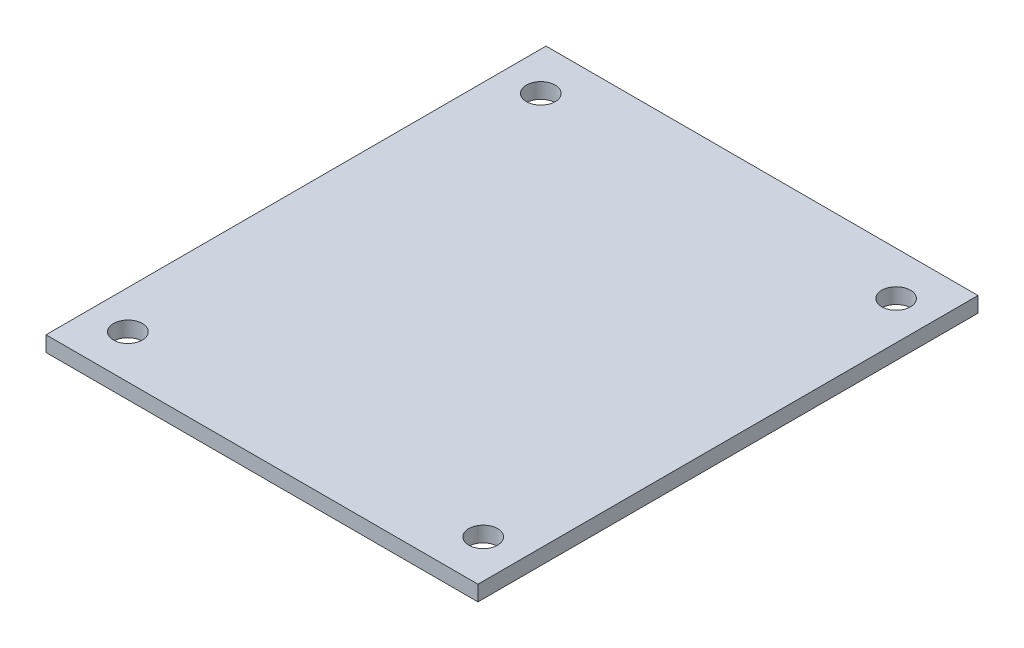
from build123d import *

# Parameters (mm, degrees)
SKETCH1_W           = 44.9834
SKETCH1_H           = 52.07
SKETCH1_R           = 1.5
BOSS_EXTRUDE1_DEPTH = 1.6


with BuildPart() as part:
    # Sketch1 → Boss-Extrude1 (new body)
    with BuildSketch(Plane(origin=(0, 0, 0), x_dir=(1, 0, 0), z_dir=(0, 1, 0))):
        with Locations((22.4917, 26.035)):
            Rectangle(SKETCH1_W, SKETCH1_H)
        with Locations(Location((3.9917, 47.535, 0), (0, 0, 270))):
            Circle(SKETCH1_R, mode=Mode.SUBTRACT)
        with Locations(Location((40.9917, 47.535, 0), (0, 0, 270))):
            Circle(SKETCH1_R, mode=Mode.SUBTRACT)
        with Locations(Location((40.9917, 4.535, 0), (0, 0, 270))):
            Circle(SKETCH1_R, mode=Mode.SUBTRACT)
        with Locations(Location((3.9917, 4.535, 0), (0, 0, 270))):
            Circle(SKETCH1_R, mode=Mode.SUBTRACT)
    extrude(amount=BOSS_EXTRUDE1_DEPTH)


solid = part.part
